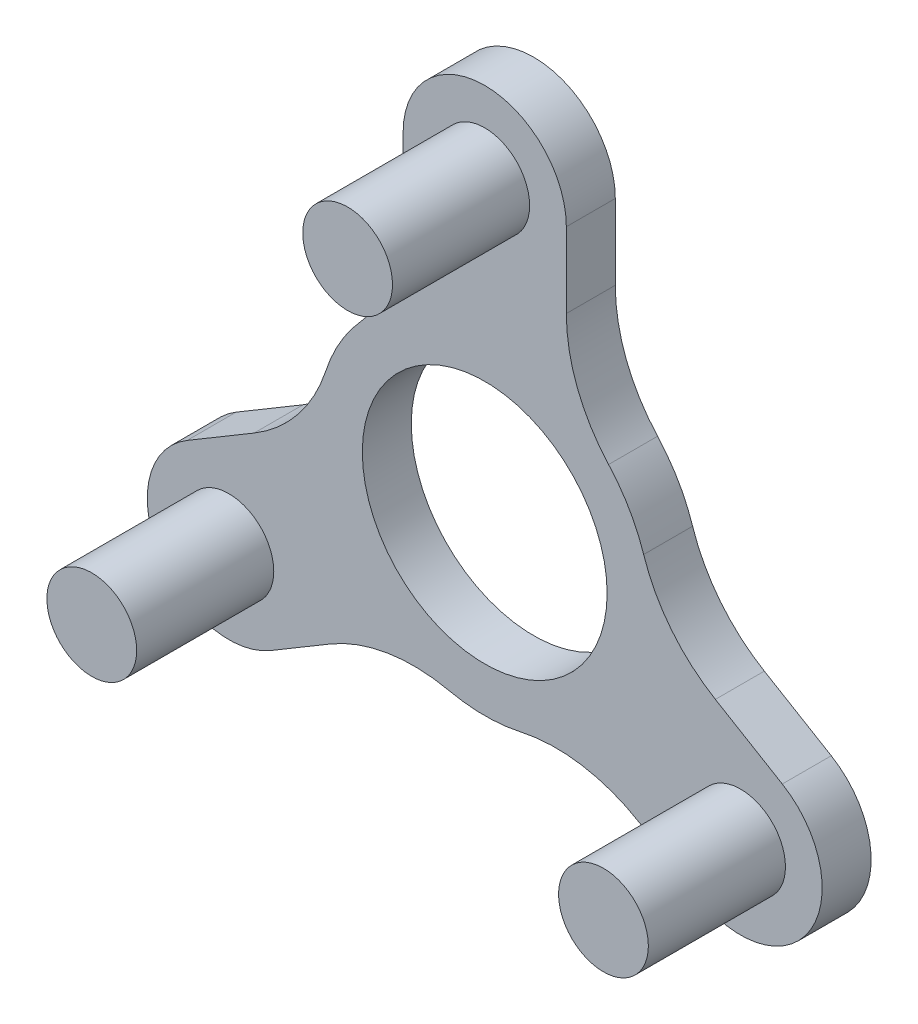
from build123d import *

# Parameters (mm, degrees)
SALIENTE_EXTRUIR1_DEPTH = 3
CROQUIS3_R              = 7.5
CORTAR_EXTRUIR2_DEPTH   = 10
REDONDEO1_R             = 10
CROQUIS2_R              = 2.75
SALIENTE_EXTRUIR2_DEPTH = 8.4


with BuildPart() as part:
    # Croquis1 → Saliente-Extruir1 (new body)
    with BuildSketch(Plane.XY):
        with BuildLine():
            Line((-13.118348224, -13.346885602), (-5.358962429, -8.729934305))
            ThreePointArc((-5.358962429, -8.729934305), (0, -10.243545836), (5.358962429, -8.729934305))
            Line((5.358962429, -8.729934305), (13.118348224, -13.346885602))
            ThreePointArc((13.118348224, -13.346885602), (19.97194541, -11.606711584), (18.231771393, -4.753114398))
            Line((18.231771393, -4.753114398), (10.243545836, 0))
            ThreePointArc((10.243545836, 0), (8.83594818, 5.182301714), (5, 8.94037087))
            Line((5, 8.94037087), (5, 18.2))
            ThreePointArc((5, 18.2), (0, 23.2), (-5, 18.2))
            Line((-5, 18.2), (-5, 8.94037087))
            ThreePointArc((-5, 8.94037087), (-8.83594818, 5.182301714), (-10.243545836, 0))
            Line((-10.243545836, 0), (-18.231771393, -4.753114398))
            ThreePointArc((-18.231771393, -4.753114398), (-19.97194541, -11.606711584), (-13.118348224, -13.346885602))
        make_face()
    extrude(amount=SALIENTE_EXTRUIR1_DEPTH)

    # Croquis3 → Cortar-Extruir2 (cut)
    with BuildSketch(Plane.XY.offset(3)):
        Circle(CROQUIS3_R)
    extrude(amount=-CORTAR_EXTRUIR2_DEPTH, mode=Mode.SUBTRACT)

    # Redondeo1
    redondeo1_edges = [part.edges().sort_by_distance(p)[0] for p in [
        (-10.243545836, 0, 1.5),
        (-5, 8.94037087, 1.5),
        (5, 8.94037087, 1.5),
        (10.243545836, 0, 1.5),
        (5.358962429, -8.729934305, 1.5),
        (-5.358962429, -8.729934305, 1.5),
    ]]
    fillet(redondeo1_edges, radius=REDONDEO1_R)

    # Croquis2 → Saliente-Extruir2 (add)
    with BuildSketch(Plane.XY.offset(3)):
        with Locations((0, 18.2)):
            Circle(CROQUIS2_R)
        with Locations((15.675059808, -9.05)):
            Circle(CROQUIS2_R)
        with Locations((-15.675059808, -9.05)):
            Circle(CROQUIS2_R)
    extrude(amount=SALIENTE_EXTRUIR2_DEPTH)


solid = part.part
